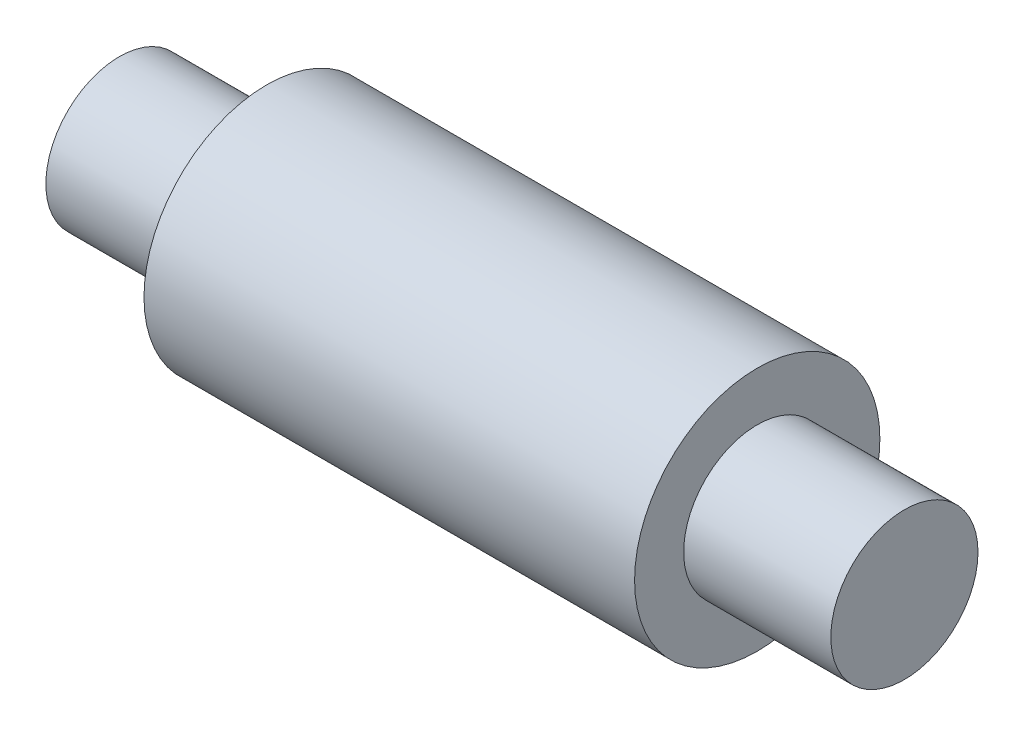
from build123d import *

# Parameters (mm, degrees)
SKETCH1_R           = 63.5
BOSS_EXTRUDE1_DEPTH = 127
SKETCH3_R           = 38.1
BOSS_EXTRUDE2_DEPTH = 203.2


with BuildPart() as part:
    # Sketch1 → Boss-Extrude1 (new, symmetric)
    with BuildSketch(Plane(origin=(0, 0, 0), x_dir=(0, 0, -1), z_dir=(1, 0, 0))):
        Circle(SKETCH1_R)
    extrude(amount=BOSS_EXTRUDE1_DEPTH, both=True)

    # Sketch3 → Boss-Extrude2 (add, symmetric)
    with BuildSketch(Plane(origin=(0, 0, 0), x_dir=(0, 0, -1), z_dir=(1, 0, 0))):
        Circle(SKETCH3_R)
    extrude(amount=BOSS_EXTRUDE2_DEPTH, both=True)


solid = part.part
